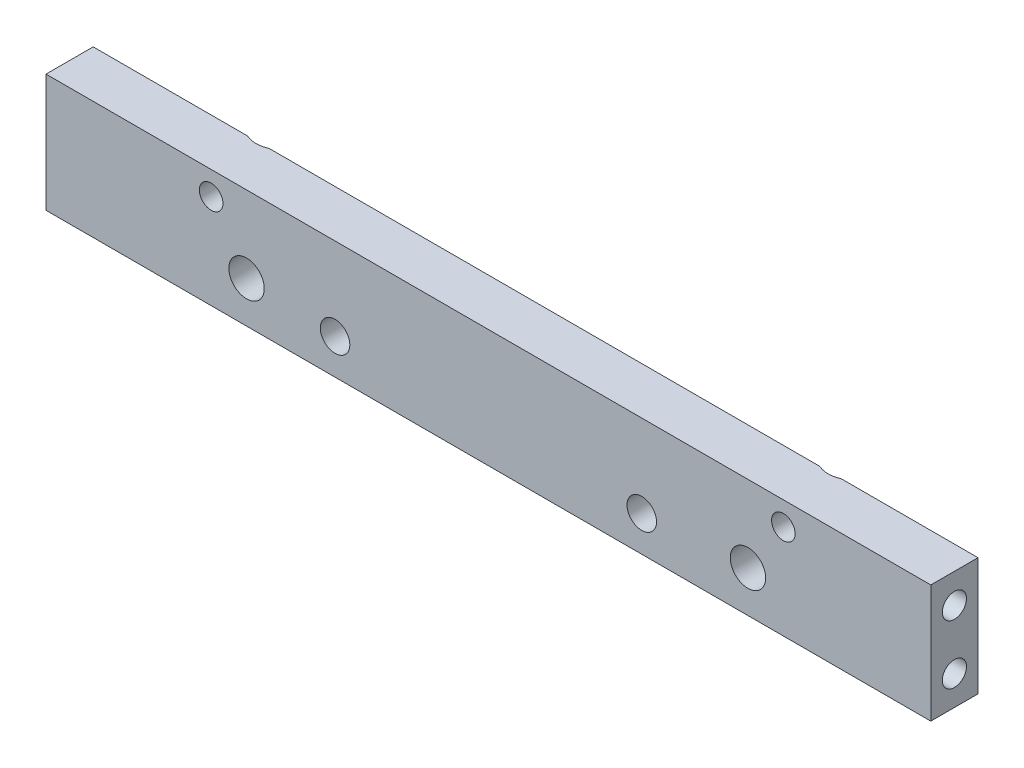
from build123d import *

# Parameters (mm, degrees)
SKETCH1_W                     = 75
SKETCH1_H                     = 10
BOSS_EXTRUDE1_DEPTH           = 4
M3X0_5_TAPPED_HOLE1_D         = 2.5
CSK_FOR_M3_SFHCS1_D           = 3
CSK_FOR_M3_SFHCS1_CSINK_D     = 5.6
CSK_FOR_M3_SFHCS1_CSINK_ANGLE = 90
CSK_FOR_M3_SFHCS2_D           = 2
CSK_FOR_M3_SFHCS2_CSINK_D     = 4.4
CSK_FOR_M3_SFHCS2_CSINK_ANGLE = 90
M2_5X0_45_TAPPED_HOLE1_D      = 2.05
M2_5X0_45_TAPPED_HOLE1_DEPTH  = 6.35
M2_5X0_45_TAPPED_HOLE1_TIP    = 0.615882135
M2_5X0_45_TAPPED_HOLE2_D      = 2.05
M2_5X0_45_TAPPED_HOLE2_DEPTH  = 6.35
M2_5X0_45_TAPPED_HOLE2_TIP    = 0.615882135


with BuildPart() as part:
    # Sketch1 → Boss-Extrude1 (new body)
    with BuildSketch(Plane.XY.offset(4)):
        Rectangle(SKETCH1_W, SKETCH1_H)
    extrude(amount=-BOSS_EXTRUDE1_DEPTH)

    # M3x0.5 Tapped Hole1 (through all)
    with Locations(Plane(origin=(0, 0, 0), x_dir=(-1, 0, 0), z_dir=(0, 0, -1))):
        with Locations((-13, -2), (13, -2)):
            Hole(M3X0_5_TAPPED_HOLE1_D / 2)

    # CSK for M3 SFHCS1 (through all)
    with Locations(Plane(origin=(0, 0, 0), x_dir=(-1, 0, 0), z_dir=(0, 0, -1))):
        with Locations((-22, -1.5), (20.5, -1.5)):
            CounterSinkHole(CSK_FOR_M3_SFHCS1_D / 2, CSK_FOR_M3_SFHCS1_CSINK_D / 2, counter_sink_angle=CSK_FOR_M3_SFHCS1_CSINK_ANGLE)

    # CSK for M3 SFHCS2 (through all)
    with Locations(Plane(origin=(0, 0, 0), x_dir=(-1, 0, 0), z_dir=(0, 0, -1))):
        with Locations((23.5, 3), (-25, 3)):
            CounterSinkHole(CSK_FOR_M3_SFHCS2_D / 2, CSK_FOR_M3_SFHCS2_CSINK_D / 2, counter_sink_angle=CSK_FOR_M3_SFHCS2_CSINK_ANGLE)

    # M2.5x0.45 Tapped Hole1
    with Locations(Plane(origin=(37.5, 0, 0), x_dir=(0, 0, -1), z_dir=(1, 0, 0))):
        with Locations((-2, 2.5), (-2, -2.5)):
            Hole(M2_5X0_45_TAPPED_HOLE1_D / 2, depth=M2_5X0_45_TAPPED_HOLE1_DEPTH)
            with Locations((0, 0, -(M2_5X0_45_TAPPED_HOLE1_DEPTH + M2_5X0_45_TAPPED_HOLE1_TIP / 2))):  # 118° drill point
                Cone(0, M2_5X0_45_TAPPED_HOLE1_D / 2, M2_5X0_45_TAPPED_HOLE1_TIP, mode=Mode.SUBTRACT)

    # M2.5x0.45 Tapped Hole2
    with Locations(Plane.ZY.offset(37.5)):
        with Locations((2, -2.5), (2, 2.5)):
            Hole(M2_5X0_45_TAPPED_HOLE2_D / 2, depth=M2_5X0_45_TAPPED_HOLE2_DEPTH)
            with Locations((0, 0, -(M2_5X0_45_TAPPED_HOLE2_DEPTH + M2_5X0_45_TAPPED_HOLE2_TIP / 2))):  # 118° drill point
                Cone(0, M2_5X0_45_TAPPED_HOLE2_D / 2, M2_5X0_45_TAPPED_HOLE2_TIP, mode=Mode.SUBTRACT)


solid = part.part
